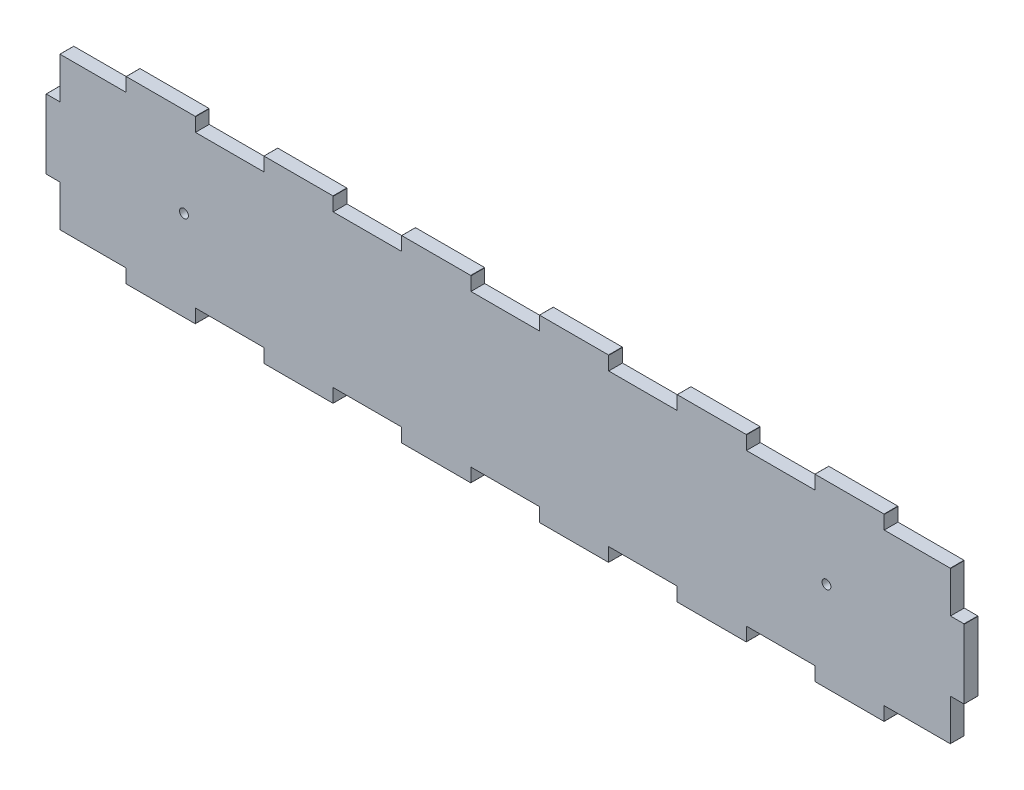
from build123d import *

# Parameters (mm, degrees)
BOSS_EXTRUDE1_DEPTH = 5
SKETCH1_R           = 1.6
CUT_EXTRUDE1_DEPTH  = 170.872450974


with BuildPart() as part:
    # Model → Boss-Extrude1 (new body)
    with BuildSketch(Plane.XY):
        Polygon((-112.44, -32.58), (-112.43, -32.57), (-112.42, -32.55), (-112.41, -32.54), (-112.4, -32.52), (-112.4, -27.6), (-87.6, -27.6), (-87.6, -32.52), (-87.58, -32.56), (-87.57, -32.57), (-87.55, -32.58), (-87.54, -32.59), (-87.52, -32.6), (-62.48, -32.6), (-62.44, -32.58), (-62.43, -32.57), (-62.42, -32.55), (-62.41, -32.54), (-62.4, -32.52), (-62.4, -27.6), (-37.6, -27.6), (-37.6, -32.52), (-37.58, -32.56), (-37.57, -32.57), (-37.55, -32.58), (-37.54, -32.59), (-37.52, -32.6), (-12.48, -32.6), (-12.44, -32.58), (-12.43, -32.57), (-12.42, -32.55), (-12.41, -32.54), (-12.4, -32.52), (-12.4, -27.6), (12.4, -27.6), (12.4, -32.52), (12.42, -32.56), (12.43, -32.57), (12.45, -32.58), (12.46, -32.59), (12.48, -32.6), (37.52, -32.6), (37.56, -32.58), (37.57, -32.57), (37.58, -32.55), (37.59, -32.54), (37.6, -32.52), (37.6, -27.6), (62.4, -27.6), (62.4, -32.52), (62.42, -32.56), (62.43, -32.57), (62.45, -32.58), (62.46, -32.59), (62.48, -32.6), (87.52, -32.6), (87.56, -32.58), (87.57, -32.57), (87.58, -32.55), (87.59, -32.54), (87.6, -32.52), (87.6, -27.6), (112.4, -27.6), (112.4, -32.52), (112.42, -32.56), (112.43, -32.57), (112.45, -32.58), (112.46, -32.59), (112.48, -32.6), (137.52, -32.6), (137.56, -32.58), (137.57, -32.57), (137.58, -32.55), (137.59, -32.54), (137.6, -32.52), (137.6, -27.6), (161.56, -27.6), (161.6, -27.58), (161.61, -27.57), (161.62, -27.55), (161.63, -27.54), (161.64, -27.52), (161.64, -12.6), (166.56, -12.6), (166.6, -12.58), (166.61, -12.57), (166.62, -12.55), (166.63, -12.54), (166.64, -12.52), (166.64, 12.52), (166.62, 12.56), (166.61, 12.57), (166.59, 12.58), (166.58, 12.59), (166.56, 12.6), (161.64, 12.6), (161.64, 27.52), (161.62, 27.56), (161.61, 27.57), (161.59, 27.58), (161.58, 27.59), (161.56, 27.6), (137.6, 27.6), (137.6, 32.52), (137.58, 32.56), (137.57, 32.57), (137.55, 32.58), (137.54, 32.59), (137.52, 32.6), (112.48, 32.6), (112.44, 32.58), (112.43, 32.57), (112.42, 32.55), (112.41, 32.54), (112.4, 32.52), (112.4, 27.6), (87.6, 27.6), (87.6, 32.52), (87.58, 32.56), (87.57, 32.57), (87.55, 32.58), (87.54, 32.59), (87.52, 32.6), (62.48, 32.6), (62.44, 32.58), (62.43, 32.57), (62.42, 32.55), (62.41, 32.54), (62.4, 32.52), (62.4, 27.6), (37.6, 27.6), (37.6, 32.52), (37.58, 32.56), (37.57, 32.57), (37.55, 32.58), (37.54, 32.59), (37.52, 32.6), (12.48, 32.6), (12.44, 32.58), (12.43, 32.57), (12.42, 32.55), (12.41, 32.54), (12.4, 32.52), (12.4, 27.6), (-12.4, 27.6), (-12.4, 32.52), (-12.42, 32.56), (-12.43, 32.57), (-12.45, 32.58), (-12.46, 32.59), (-12.48, 32.6), (-37.52, 32.6), (-37.56, 32.58), (-37.57, 32.57), (-37.58, 32.55), (-37.59, 32.54), (-37.6, 32.52), (-37.6, 27.6), (-62.4, 27.6), (-62.4, 32.52), (-62.42, 32.56), (-62.43, 32.57), (-62.45, 32.58), (-62.46, 32.59), (-62.48, 32.6), (-87.52, 32.6), (-87.56, 32.58), (-87.57, 32.57), (-87.58, 32.55), (-87.59, 32.54), (-87.6, 32.52), (-87.6, 27.6), (-112.4, 27.6), (-112.4, 32.52), (-112.42, 32.56), (-112.43, 32.57), (-112.45, 32.58), (-112.46, 32.59), (-112.48, 32.6), (-137.52, 32.6), (-137.56, 32.58), (-137.57, 32.57), (-137.58, 32.55), (-137.59, 32.54), (-137.6, 32.52), (-137.6, 27.6), (-161.56, 27.6), (-161.6, 27.58), (-161.61, 27.57), (-161.62, 27.55), (-161.63, 27.54), (-161.64, 27.52), (-161.64, 12.6), (-166.56, 12.6), (-166.6, 12.58), (-166.61, 12.57), (-166.62, 12.55), (-166.63, 12.54), (-166.64, 12.52), (-166.64, -12.52), (-166.62, -12.56), (-166.61, -12.57), (-166.59, -12.58), (-166.58, -12.59), (-166.56, -12.6), (-161.64, -12.6), (-161.64, -27.52), (-161.62, -27.56), (-161.61, -27.57), (-161.59, -27.58), (-161.58, -27.59), (-161.56, -27.6), (-137.6, -27.6), (-137.6, -32.52), (-137.58, -32.56), (-137.57, -32.57), (-137.55, -32.58), (-137.54, -32.59), (-137.52, -32.6), (-112.48, -32.6), align=None)
    extrude(amount=BOSS_EXTRUDE1_DEPTH)

    # Sketch1 → Cut-Extrude1 (cut, through all)
    with BuildSketch(Plane.XY.offset(5)):
        with Locations((-116.565, 0.04)):
            Circle(SKETCH1_R)
        with Locations(Location((116.645, 0.04, 0), (0, 0, 180))):
            Circle(SKETCH1_R)
    extrude(amount=-CUT_EXTRUDE1_DEPTH, mode=Mode.SUBTRACT)


solid = part.part
